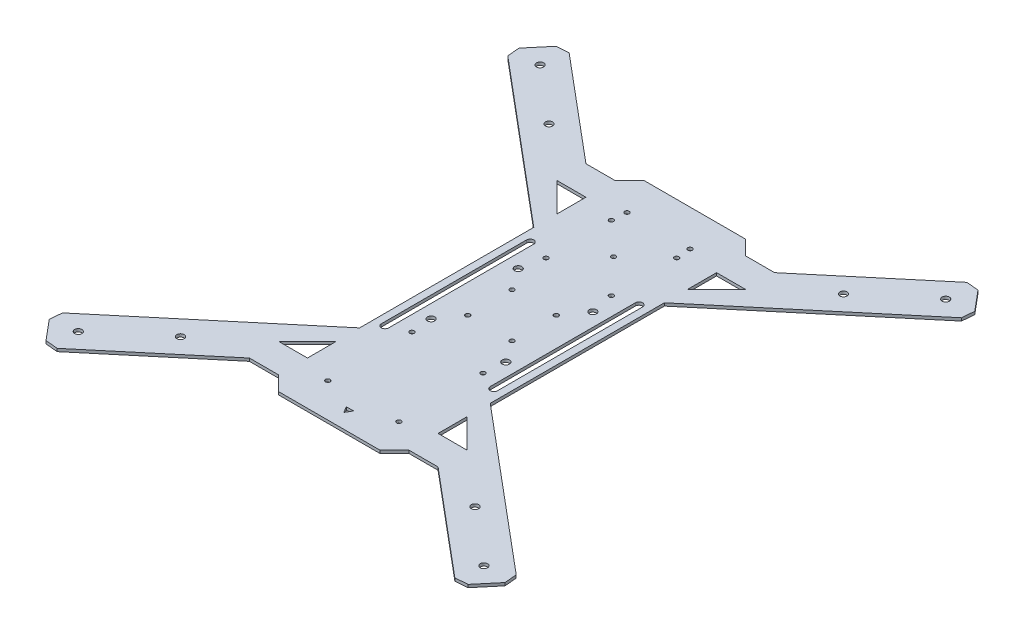
from build123d import *

# Parameters (mm, degrees)
Y_KSEKLIK_EKSTR_ZYON2_DEPTH = 2
IZIM3_R                     = 1.55
KES_EKSTR_ZYON1_DEPTH       = 2
KES_EKSTR_ZYON2_DEPTH       = 2
KES_EKSTR_ZYON3_DEPTH       = 20
PAH1_SIZE                   = 6
IZIM6_R                     = 2.5
KES_EKSTR_ZYON4_DEPTH       = 20
IZIM7_R                     = 1.55
KES_EKSTR_ZYON6_DEPTH       = 20
IZIM8_R                     = 1.55
KES_EKSTR_ZYON7_DEPTH       = 2
KES_EKSTR_ZYON8_DEPTH       = 10
IZIM10_R                    = 2.5
KES_EKSTR_ZYON9_DEPTH       = 10


with BuildPart() as part:
    # Çizim2 → Yükseklik-Ekstrüzyon2 (new body)
    with BuildSketch(Plane(origin=(0, 0, 0), x_dir=(1, 0, 0), z_dir=(0, 1, 0))):
        Polygon((-160.888072602, 157.241638979), (-45, 60), (-45, -60), (-160.888072602, -157.241638979), (-141.604444312, -180.222972272), (-65, -115.944211304), (-45, -115.944211304), (-35, -125.944211304), (35, -125.944211304), (45, -115.944211304), (65, -115.944211304), (141.604444312, -180.222972272), (160.888072602, -157.241638979), (45, -60), (45, 60), (160.888072602, 157.241638979), (141.604444312, 180.222972272), (65, 115.944211304), (45, 115.944211304), (35, 125.944211304), (-35, 125.944211304), (-45, 115.944211304), (-65, 115.944211304), (-141.604444312, 180.222972272), align=None)
    extrude(amount=Y_KSEKLIK_EKSTR_ZYON2_DEPTH)

    # Çizim3 → Kes-Ekstrüzyon1 (cut)
    with BuildSketch(Plane(origin=(0, 2, 0), x_dir=(1, 0, 0), z_dir=(0, 1, 0))):
        with Locations(Location((-22.5, 90.944211304, 0), (0, 0, 270))):
            Circle(IZIM3_R)
        with Locations(Location((22.5, 90.944211304, 0), (0, 0, 270))):
            Circle(IZIM3_R)
        with Locations(Location((-22.5, 45.944211304, 0), (0, 0, 270))):
            Circle(IZIM3_R)
        with Locations(Location((22.5, 45.944211304, 0), (0, 0, 270))):
            Circle(IZIM3_R)
        with Locations(Location((-15.25, 15.25, 0), (0, 0, 270))):
            Circle(IZIM3_R)
        with Locations(Location((15.25, 15.25, 0), (0, 0, 270))):
            Circle(IZIM3_R)
        with Locations(Location((15.25, -15.25, 0), (0, 0, 270))):
            Circle(IZIM3_R)
        with Locations(Location((-15.25, -15.25, 0), (0, 0, 270))):
            Circle(IZIM3_R)
    extrude(amount=-KES_EKSTR_ZYON1_DEPTH, mode=Mode.SUBTRACT)

    # Çizim4 → Kes-Ekstrüzyon2 (cut)
    with BuildSketch(Plane(origin=(0, 2, 0), x_dir=(1, 0, 0), z_dir=(0, 1, 0))):
        Polygon((-2.5, -111.614084285), (0, -115.944211304), (2.5, -111.614084285), align=None)
    extrude(amount=-KES_EKSTR_ZYON2_DEPTH, mode=Mode.SUBTRACT)

    # Çizim5 → Kes-Ekstrüzyon3 (cut)
    with BuildSketch(Plane(origin=(0, 2, 0), x_dir=(1, 0, 0), z_dir=(0, 1, 0))):
        Polygon((-65, 95.944211304), (-45, 95.944211304), (-45, 75.944211304), align=None)
        Polygon((45, 75.944211304), (65, 95.944211304), (45, 95.944211304), align=None)
        Polygon((65, -95.944211304), (45, -95.944211304), (45, -75.944211304), align=None)
        Polygon((-45, -75.944211304), (-65, -95.944211304), (-45, -95.944211304), align=None)
    extrude(amount=-KES_EKSTR_ZYON3_DEPTH, mode=Mode.SUBTRACT)

    # Pah1
    pah1_edges = [part.edges().sort_by_distance(p)[0] for p in [
        (-160.888072602, 1, -157.241638979),
        (-141.604444312, 1, -180.222972272),
        (141.604444312, 1, -180.222972272),
        (160.888072602, 1, -157.241638979),
        (160.888072602, 1, 157.241638979),
        (141.604444312, 1, 180.222972272),
        (-141.604444312, 1, 180.222972272),
        (-160.888072602, 1, 157.241638979),
    ]]
    chamfer(pah1_edges, length=PAH1_SIZE)

    # Çizim6 → Kes-Ekstrüzyon4 (cut)
    with BuildSketch(Plane(origin=(0, 2, 0), x_dir=(1, 0, 0), z_dir=(0, 1, 0))):
        with Locations(Location((-139.75559181, 159.09049148, 0), (0, 0, 270))):
            Circle(IZIM6_R)
        with Locations(Location((-101.453369654, 126.951110996, 0), (0, 0, 270))):
            Circle(IZIM6_R)
        with Locations(Location((139.75559181, 159.09049148, 0), (0, 0, 270))):
            Circle(IZIM6_R)
        with Locations(Location((101.453369654, 126.951110996, 0), (0, 0, 270))):
            Circle(IZIM6_R)
        with Locations(Location((-139.75559181, -159.09049148, 0), (0, 0, 270))):
            Circle(IZIM6_R)
        with Locations(Location((-101.453369654, -126.951110996, 0), (0, 0, 270))):
            Circle(IZIM6_R)
        with Locations(Location((101.453369654, -126.951110996, 0), (0, 0, 270))):
            Circle(IZIM6_R)
        with Locations(Location((139.75559181, -159.09049148, 0), (0, 0, 270))):
            Circle(IZIM6_R)
    extrude(amount=-KES_EKSTR_ZYON4_DEPTH, mode=Mode.SUBTRACT)

    # Çizim7 → Kes-Ekstrüzyon6 (cut)
    with BuildSketch(Plane(origin=(0, 2, 0), x_dir=(1, 0, 0), z_dir=(0, 1, 0))):
        with Locations(Location((-24.5, -44.444211304, 0), (0, 0, 270))):
            Circle(IZIM7_R)
        with Locations(Location((-24.5, -102.444211304, 0), (0, 0, 270))):
            Circle(IZIM7_R)
        with Locations(Location((24.5, -102.444211304, 0), (0, 0, 270))):
            Circle(IZIM7_R)
        with Locations(Location((24.5, -44.444211304, 0), (0, 0, 270))):
            Circle(IZIM7_R)
    extrude(amount=-KES_EKSTR_ZYON6_DEPTH, mode=Mode.SUBTRACT)

    # Çizim8 → Kes-Ekstrüzyon7 (cut)
    with BuildSketch(Plane(origin=(0, 2, 0), x_dir=(1, 0, 0), z_dir=(0, 1, 0))):
        with Locations(Location((0, 69.944211304, 0), (0, 0, 270))):
            Circle(IZIM8_R)
        with Locations(Location((-21.75, 100.944211304, 0), (0, 0, 270))):
            Circle(IZIM8_R)
        with Locations(Location((21.75, 100.944211304, 0), (0, 0, 270))):
            Circle(IZIM8_R)
    extrude(amount=-KES_EKSTR_ZYON7_DEPTH, mode=Mode.SUBTRACT)

    # Çizim9 → Kes-Ekstrüzyon8 (cut)
    with BuildSketch(Plane(origin=(0, 2, 0), x_dir=(1, 0, 0), z_dir=(0, 1, 0))):
        with BuildLine():
            Line((-35, 50), (-35, -50))
            ThreePointArc((-35, -50), (-37.5, -52.5), (-40, -50))
            Line((-40, -50), (-40, 50))
            ThreePointArc((-40, 50), (-37.5, 52.5), (-35, 50))
        make_face()
        with BuildLine():
            Line((40, 50), (40, -50))
            ThreePointArc((40, -50), (37.5, -52.5), (35, -50))
            Line((35, -50), (35, 50))
            ThreePointArc((35, 50), (37.5, 52.5), (40, 50))
        make_face()
    extrude(amount=-KES_EKSTR_ZYON8_DEPTH, mode=Mode.SUBTRACT)

    # Çizim10 → Kes-Ekstrüzyon9 (cut)
    with BuildSketch(Plane(origin=(0, 2, 0), x_dir=(1, 0, 0), z_dir=(0, 1, 0))):
        with Locations(Location((25.75, -30, 0), (0, 0, 270))):
            Circle(IZIM10_R)
        with Locations(Location((-25.75, -30, 0), (0, 0, 270))):
            Circle(IZIM10_R)
        with Locations(Location((25.75, 30, 0), (0, 0, 270))):
            Circle(IZIM10_R)
        with Locations(Location((-25.75, 30, 0), (0, 0, 270))):
            Circle(IZIM10_R)
    extrude(amount=-KES_EKSTR_ZYON9_DEPTH, mode=Mode.SUBTRACT)


solid = part.part
